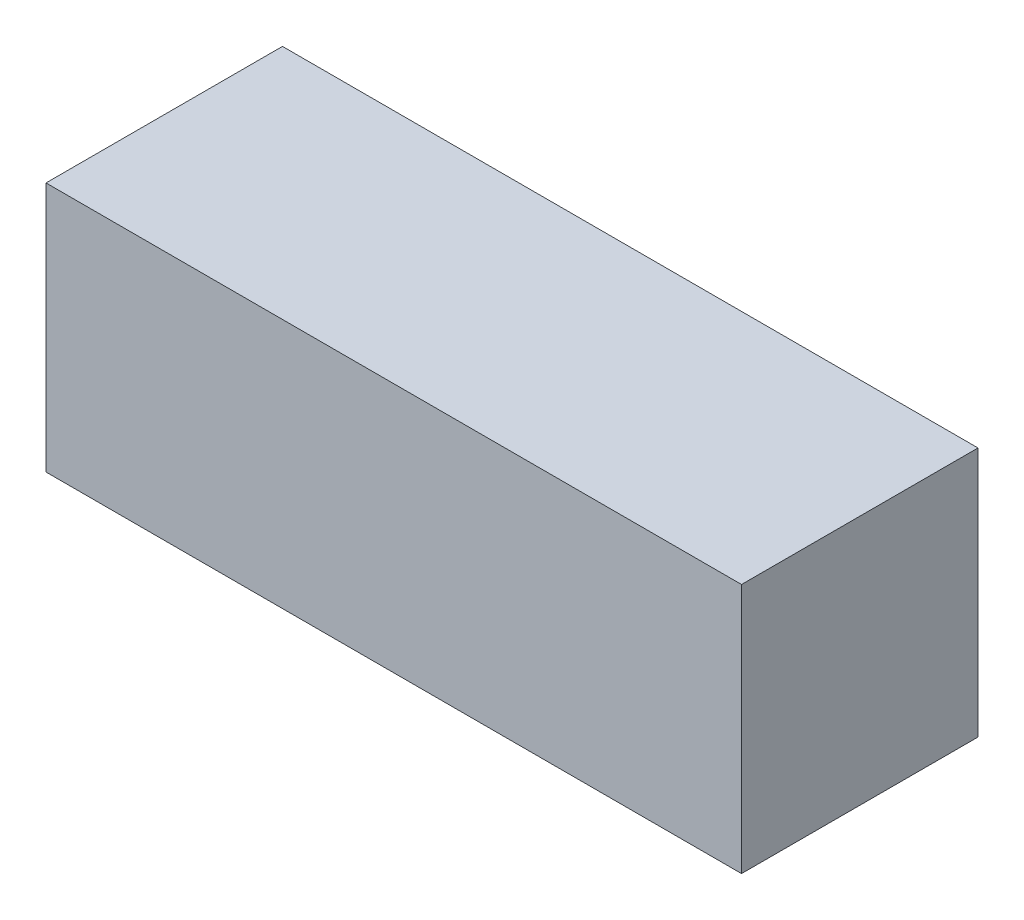
from build123d import *

# Parameters (mm, degrees)
SKETCH1_W           = 1270
SKETCH1_H           = 431.8
BOSS_EXTRUDE1_DEPTH = 457.2


with BuildPart() as part:
    # Sketch1 → Boss-Extrude1 (new body)
    with BuildSketch(Plane(origin=(0, 0, 0), x_dir=(1, 0, 0), z_dir=(0, 1, 0))):
        Rectangle(SKETCH1_W, SKETCH1_H)
    extrude(amount=BOSS_EXTRUDE1_DEPTH)


solid = part.part
